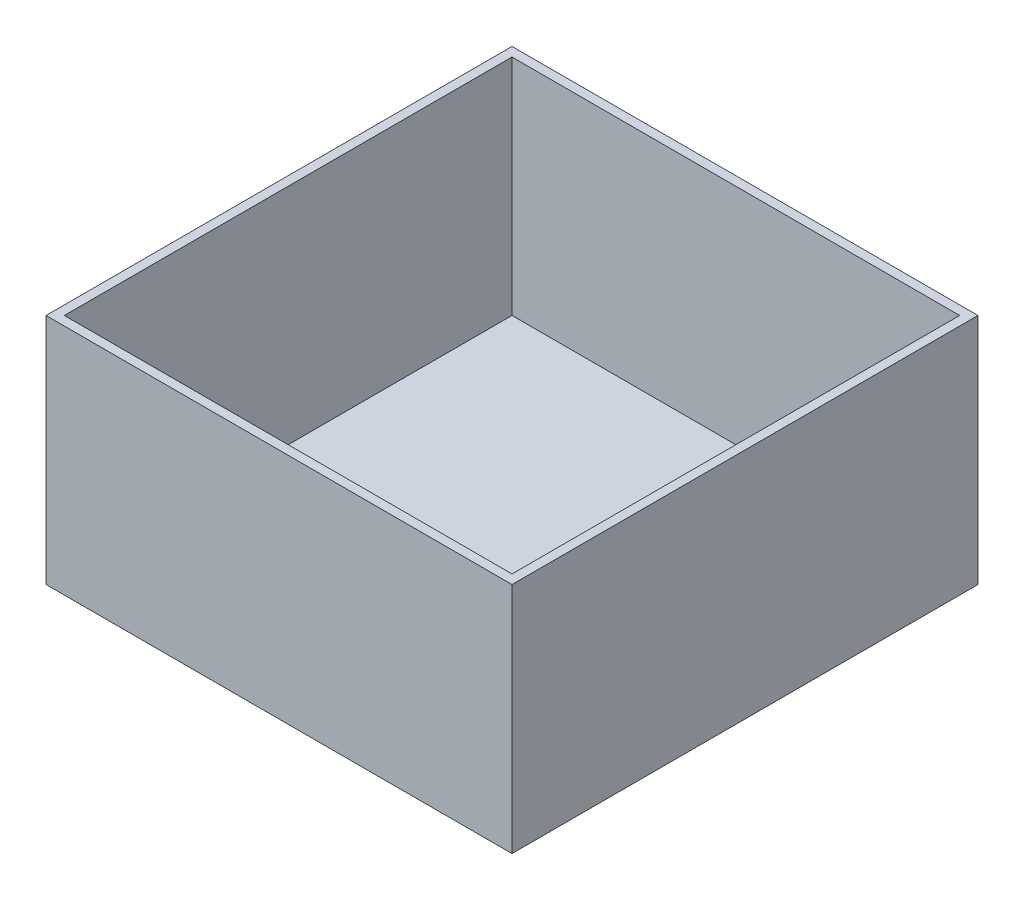
from build123d import *

# Parameters (mm, degrees)
SKETCH1_W           = 101.6
SKETCH1_H           = 101.6
BOSS_EXTRUDE1_DEPTH = 50.8
SHELL1_T            = -2


with BuildPart() as part:
    # Sketch1 → Boss-Extrude1 (new body)
    with BuildSketch(Plane(origin=(0, 0, 0), x_dir=(1, 0, 0), z_dir=(0, 1, 0))):
        Rectangle(SKETCH1_W, SKETCH1_H)
    extrude(amount=BOSS_EXTRUDE1_DEPTH)

    # Shell1
    shell1_openings = [part.faces().sort_by_distance(p)[0] for p in [
        (0, 50.8, 0),
    ]]
    offset(amount=SHELL1_T, openings=shell1_openings, kind=Kind.INTERSECTION)


solid = part.part
